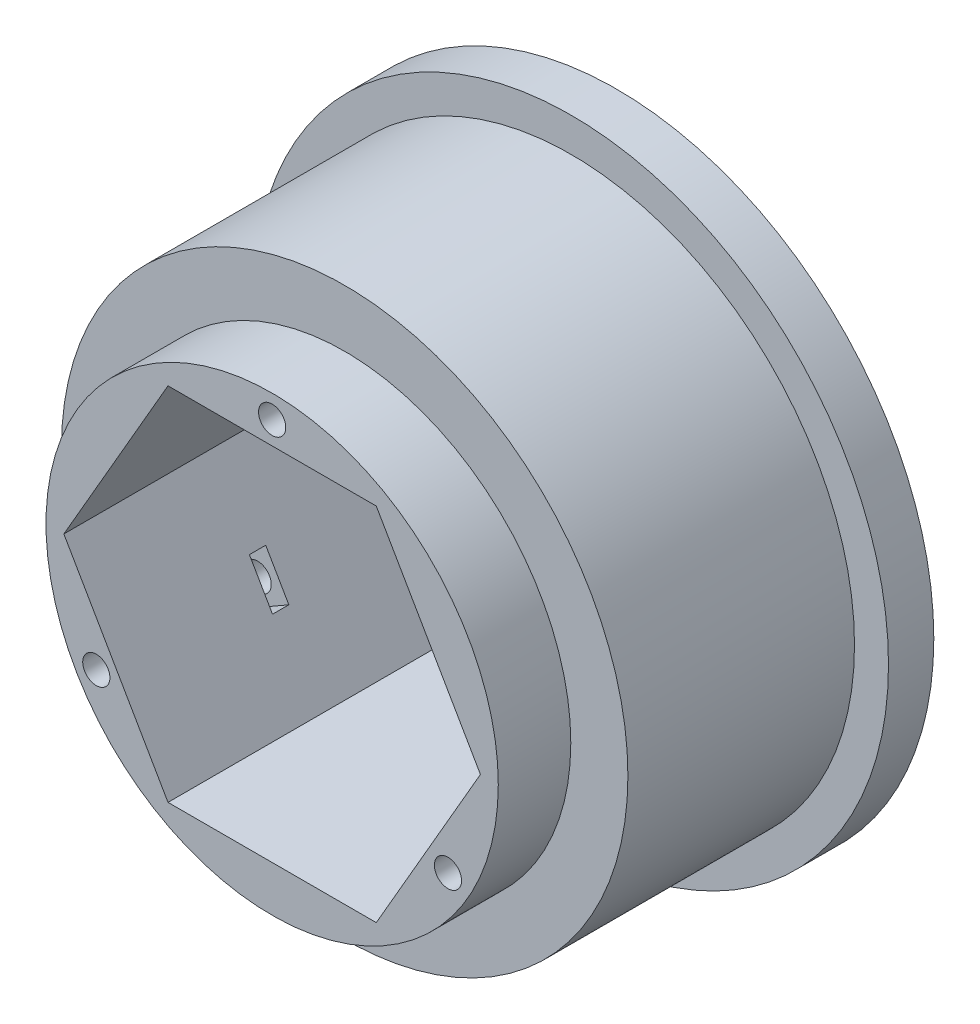
from build123d import *

# Parameters (mm, degrees)
CUT_EXTRUDE1_DEPTH = 71.512410255
SKETCH3_R          = 1.5
CUT_EXTRUDE2_DEPTH = 20
SKETCH4_W          = 5.1
SKETCH4_H          = 5.05
CUT_EXTRUDE3_DEPTH = 1.8
SKETCH6_R          = 2.55
CUT_EXTRUDE4_DEPTH = 3
SKETCH7_R          = 1.75
CUT_EXTRUDE5_DEPTH = 3
SKETCH8_OUTSIDE_W  = 110.944
SKETCH8_OUTSIDE_H  = 110.944
SKETCH8_OUTSIDE_R  = 35
CUT_EXTRUDE6_DEPTH = 71.512410255


with BuildPart() as part:
    # Sketch1 → Revolve1 (revolve)
    with BuildSketch(Plane(origin=(0, 0, 0), x_dir=(1, 0, 0), z_dir=(0, 1, 0))):
        Polygon((19.9, -38), (19.9, -5), (24.95, -5), (24.95, -10), (28.1, -10), (28.1, 0), (42, 0), (42, -5), (31.25, -5), (31.25, -30), (24.95, -30), (24.95, -38), align=None)
    revolve(axis=Axis((0, 0, 57.825795551), (0, 0, -1)))

    # Sketch2 → Cut-Extrude1 (cut, through all)
    with BuildSketch(Plane.XY.offset(38)):
        Polygon((-22.978540714, 0), (-11.489270357, -19.9), (11.489270357, -19.9), (22.978540714, 0), (11.489270357, 19.9), (-11.489270357, 19.9), align=None)
    extrude(amount=-CUT_EXTRUDE1_DEPTH, mode=Mode.SUBTRACT)

    # Sketch3 → Cut-Extrude2 (cut)
    with BuildSketch(Plane.XY.offset(38)):
        with Locations((0, 22.4)):
            Circle(SKETCH3_R)
        with Locations((19.398969045, -11.2)):
            Circle(SKETCH3_R)
        with Locations((-19.398969045, -11.2)):
            Circle(SKETCH3_R)
    extrude(amount=-CUT_EXTRUDE2_DEPTH, mode=Mode.SUBTRACT)

    # Sketch4 → Cut-Extrude3 (cut)
    with BuildSketch(Plane.XY.offset(22)):
        with Locations((0, 22.425)):
            Rectangle(SKETCH4_W, SKETCH4_H)
        Polygon((18.508905535, -7.74163522), (15.958905535, -12.15836478), (20.332333824, -14.68336478), (22.882333824, -10.26663522), align=None)
        Polygon((-15.958905535, -12.15836478), (-18.508905535, -7.74163522), (-22.882333824, -10.26663522), (-20.332333824, -14.68336478), align=None)
    extrude(amount=-CUT_EXTRUDE3_DEPTH, mode=Mode.SUBTRACT)

    # Sketch6 → Cut-Extrude4 (cut)
    with BuildSketch(Plane(origin=(0, 0, 0), x_dir=(-1, 0, 0), z_dir=(0, 0, -1))):
        with Locations((0, 38)):
            Circle(SKETCH6_R)
        with Locations((38, 0)):
            Circle(SKETCH6_R)
        with Locations((0, -38)):
            Circle(SKETCH6_R)
        with Locations((-38, 0)):
            Circle(SKETCH6_R)
    extrude(amount=-CUT_EXTRUDE4_DEPTH, mode=Mode.SUBTRACT)

    # Sketch7 → Cut-Extrude5 (cut)
    with BuildSketch(Plane(origin=(0, 0, 3), x_dir=(-1, 0, 0), z_dir=(0, 0, -1))):
        with Locations((0, 38)):
            Circle(SKETCH7_R)
        with Locations((38, 0)):
            Circle(SKETCH7_R)
        with Locations((0, -38)):
            Circle(SKETCH7_R)
        with Locations((-38, 0)):
            Circle(SKETCH7_R)
    extrude(amount=-CUT_EXTRUDE5_DEPTH, mode=Mode.SUBTRACT)

    # Sketch8 outside → Cut-Extrude6 (cut, through all)
    with BuildSketch(Plane.XY):
        Rectangle(SKETCH8_OUTSIDE_W, SKETCH8_OUTSIDE_H)
        Circle(SKETCH8_OUTSIDE_R, mode=Mode.SUBTRACT)
    extrude(amount=CUT_EXTRUDE6_DEPTH, mode=Mode.SUBTRACT)


solid = part.part
